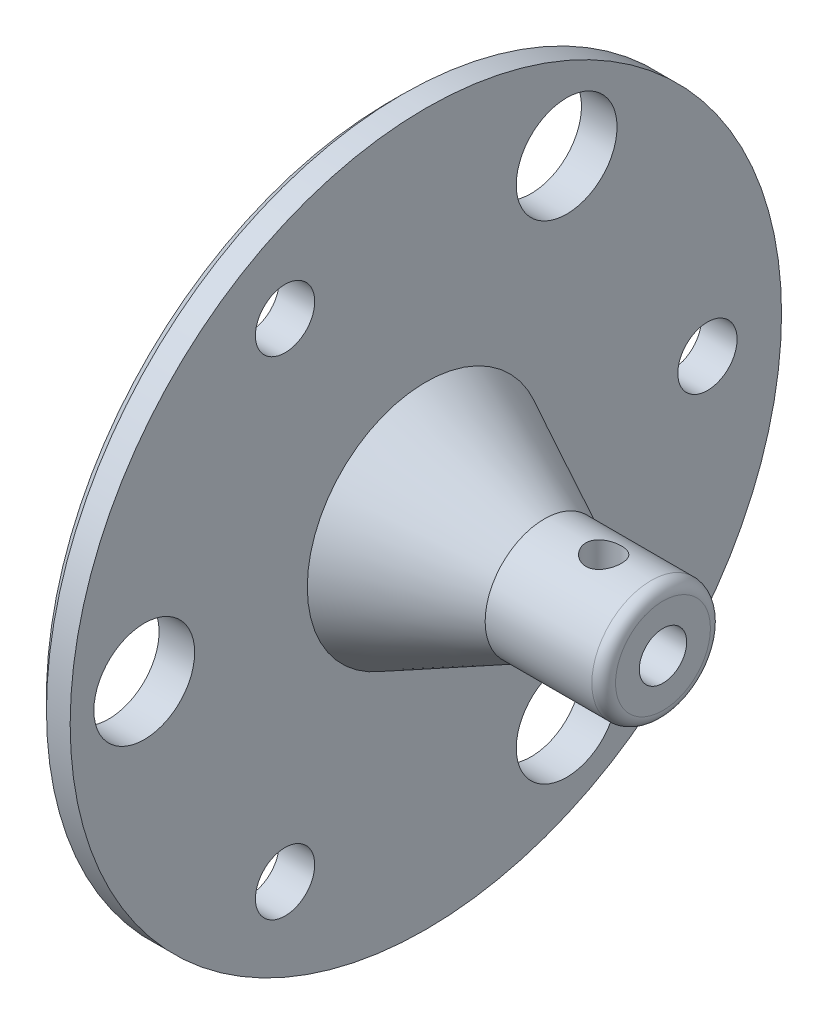
from build123d import *

# Parameters (mm, degrees)
SKETCH1_R           = 30
BOSS_EXTRUDE1_DEPTH = 3
SKETCH2_R           = 10
BOSS_EXTRUDE2_DEPTH = 10
SKETCH3_R           = 5
BOSS_EXTRUDE3_DEPTH = 10
SKETCH6_R           = 2
CUT_EXTRUDE1_DEPTH  = 49.259714048
CUT_EXTRUDE2_REACH  = 50.26
SKETCH7_R           = 4.25
SKETCH7_R_2         = 2.5
SKETCH8_R           = 1.5
CUT_EXTRUDE3_DEPTH  = 15
FILLET1_R           = 1
CHAMFER1_SIZE       = 1
CHAMFER2_SIZE       = 1


with BuildPart() as part:
    # Sketch1 → Boss-Extrude1 (new body)
    with BuildSketch(Plane(origin=(0, 0, 0), x_dir=(0, 0, -1), z_dir=(1, 0, 0))):
        Circle(SKETCH1_R)
    extrude(amount=-BOSS_EXTRUDE1_DEPTH)

    # Sketch2 → Boss-Extrude2 (add)
    with BuildSketch(Plane(origin=(0, 0, 0), x_dir=(0, 0, -1), z_dir=(1, 0, 0))):
        Circle(SKETCH2_R)
    extrude(amount=BOSS_EXTRUDE2_DEPTH)

    # Sketch3 → Boss-Extrude3 (add)
    with BuildSketch(Plane(origin=(10, 0, 0), x_dir=(0, 0, -1), z_dir=(1, 0, 0))):
        Circle(SKETCH3_R)
    extrude(amount=BOSS_EXTRUDE3_DEPTH)

    # Sketch4 → Cut-Revolve1 (revolve, cut)
    with BuildSketch(Plane.XY, mode=Mode.PRIVATE) as cut_revolve1_sk:
        Polygon((10, 5), (0, 10), (10, 10), align=None)
    revolve(cut_revolve1_sk.sketch.rotate(Axis((0, 0, 0), (1, 0, 0)), 90), axis=Axis((0, 0, 0), (1, 0, 0)), mode=Mode.SUBTRACT)

    # Sketch6 → Cut-Extrude1 (cut, through all)
    with BuildSketch(Plane(origin=(20, 0, 0), x_dir=(0, 0, -1), z_dir=(1, 0, 0))):
        Circle(SKETCH6_R)
    extrude(amount=-CUT_EXTRUDE1_DEPTH, mode=Mode.SUBTRACT)

    # Sketch7 → Cut-Extrude2 (cut, up to next)
    with BuildSketch(Plane.ZY.offset(3), mode=Mode.PRIVATE) as cut_extrude2_sk1:
        with Locations((-11.875, 20.56810334)):
            Circle(SKETCH7_R)
    cut_extrude2_tool1 = extrude(cut_extrude2_sk1.sketch, amount=-CUT_EXTRUDE2_REACH, mode=Mode.PRIVATE) & part.part
    # Sketch7 → Cut-Extrude2 (cut, up to next)
    with BuildSketch(Plane.ZY.offset(3), mode=Mode.PRIVATE) as cut_extrude2_sk2:
        with Locations((23.75, 0)):
            Circle(SKETCH7_R)
    cut_extrude2_tool2 = extrude(cut_extrude2_sk2.sketch, amount=-CUT_EXTRUDE2_REACH, mode=Mode.PRIVATE) & part.part
    # Sketch7 → Cut-Extrude2 (cut, up to next)
    with BuildSketch(Plane.ZY.offset(3), mode=Mode.PRIVATE) as cut_extrude2_sk3:
        with Locations((-11.875, -20.56810334)):
            Circle(SKETCH7_R)
    cut_extrude2_tool3 = extrude(cut_extrude2_sk3.sketch, amount=-CUT_EXTRUDE2_REACH, mode=Mode.PRIVATE) & part.part
    # Sketch7 → Cut-Extrude2 (cut, up to next)
    with BuildSketch(Plane.ZY.offset(3), mode=Mode.PRIVATE) as cut_extrude2_sk4:
        with Locations((11.875, 20.56810334)):
            Circle(SKETCH7_R_2)
    cut_extrude2_tool4 = extrude(cut_extrude2_sk4.sketch, amount=-CUT_EXTRUDE2_REACH, mode=Mode.PRIVATE) & part.part
    # Sketch7 → Cut-Extrude2 (cut, up to next)
    with BuildSketch(Plane.ZY.offset(3), mode=Mode.PRIVATE) as cut_extrude2_sk5:
        with Locations((11.875, -20.56810334)):
            Circle(SKETCH7_R_2)
    cut_extrude2_tool5 = extrude(cut_extrude2_sk5.sketch, amount=-CUT_EXTRUDE2_REACH, mode=Mode.PRIVATE) & part.part
    # Sketch7 → Cut-Extrude2 (cut, up to next)
    with BuildSketch(Plane.ZY.offset(3), mode=Mode.PRIVATE) as cut_extrude2_sk6:
        with Locations((-23.75, 0)):
            Circle(SKETCH7_R_2)
    cut_extrude2_tool6 = extrude(cut_extrude2_sk6.sketch, amount=-CUT_EXTRUDE2_REACH, mode=Mode.PRIVATE) & part.part
    add(cut_extrude2_tool1.solids().sort_by_distance((-3, 20.568103, -11.875))[0], mode=Mode.SUBTRACT)
    add(cut_extrude2_tool2.solids().sort_by_distance((-3, 0, 23.75))[0], mode=Mode.SUBTRACT)
    add(cut_extrude2_tool3.solids().sort_by_distance((-3, -20.568103, -11.875))[0], mode=Mode.SUBTRACT)
    add(cut_extrude2_tool4.solids().sort_by_distance((-3, 20.568103, 11.875))[0], mode=Mode.SUBTRACT)
    add(cut_extrude2_tool5.solids().sort_by_distance((-3, -20.568103, 11.875))[0], mode=Mode.SUBTRACT)
    add(cut_extrude2_tool6.solids().sort_by_distance((-3, 0, -23.75))[0], mode=Mode.SUBTRACT)

    # Sketch8 → Cut-Extrude3 (cut)
    with BuildSketch(Plane(origin=(0, 0, 0), x_dir=(1, 0, 0), z_dir=(0, 1, 0))):
        with Locations(Location((15, 0, 0), (0, 0, 90))):
            Circle(SKETCH8_R)
    extrude(amount=CUT_EXTRUDE3_DEPTH, mode=Mode.SUBTRACT)

    # Fillet1
    fillet1_edges = [part.edges().sort_by_distance(p)[0] for p in [
        (20, 0, 5),
    ]]
    fillet(fillet1_edges, radius=FILLET1_R)

    # Chamfer1
    chamfer1_edges = [part.edges().sort_by_distance(p)[0] for p in [
        (-3, 0, 30),
    ]]
    chamfer(chamfer1_edges, length=CHAMFER1_SIZE)

    # Chamfer2
    chamfer2_edges = [part.edges().sort_by_distance(p)[0] for p in [
        (-3, 0, 2),
    ]]
    chamfer(chamfer2_edges, length=CHAMFER2_SIZE)


solid = part.part
